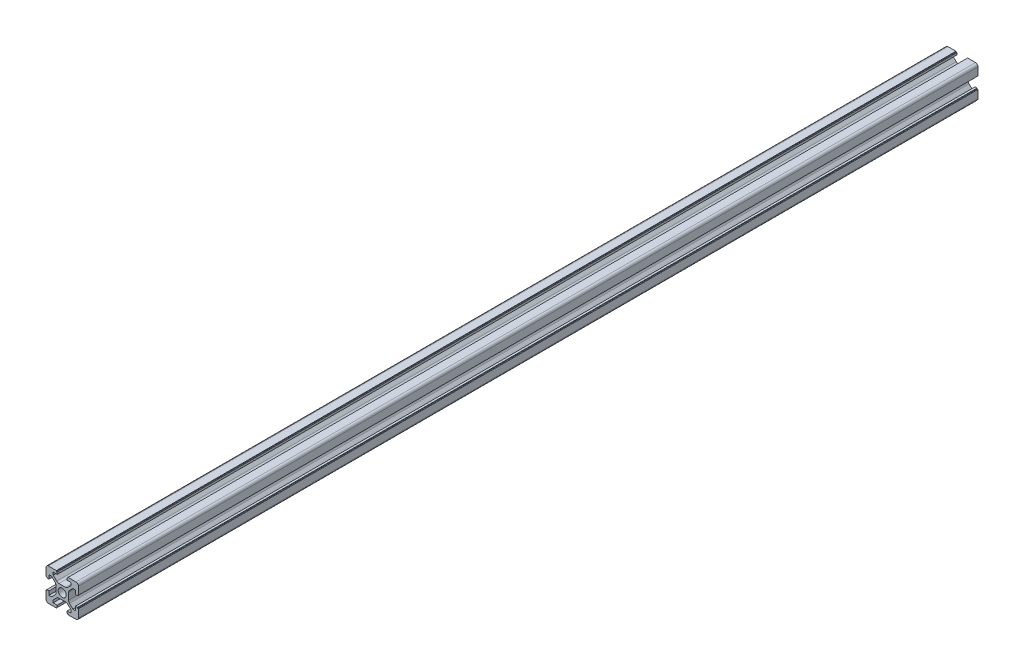
from build123d import *

# Parameters (mm, degrees)
SKETCH1_R      = 2.5
EXTRUDE1_DEPTH = 555


with BuildPart() as part:
    # Sketch1 → Extrude1 (new body)
    with BuildSketch(Plane.XY):
        with BuildLine():
            Line((0, 3.9), (-2.010912703, 3.9))
            ThreePointArc((-2.010912703, 3.9), (-2.776279568, 4.052240935), (-3.425126266, 4.485786438))
            Line((-3.425126266, 4.485786438), (-5.539339828, 6.6))
            Line((-5.539339828, 6.6), (-5.539339828, 8.2))
            Line((-5.539339828, 8.2), (-3.1, 8.2))
            Line((-3.1, 8.2), (-3.1, 9.5))
            Line((-3.1, 9.5), (-3.4, 9.5))
            ThreePointArc((-3.4, 9.5), (-3.541421356, 9.558578644), (-3.6, 9.7))
            Line((-3.6, 9.7), (-3.6, 10))
            Line((-3.6, 10), (-8.5, 10))
            ThreePointArc((-8.5, 10), (-9.560660172, 9.560660172), (-10, 8.5))
            Line((-10, 8.5), (-10, 3.6))
            Line((-10, 3.6), (-9.7, 3.6))
            ThreePointArc((-9.7, 3.6), (-9.558578644, 3.541421356), (-9.5, 3.4))
            Line((-9.5, 3.4), (-9.5, 3.1))
            Line((-9.5, 3.1), (-8.2, 3.1))
            Line((-8.2, 3.1), (-8.2, 5.539339828))
            Line((-8.2, 5.539339828), (-6.6, 5.539339828))
            Line((-6.6, 5.539339828), (-4.485786438, 3.425126266))
            ThreePointArc((-4.485786438, 3.425126266), (-4.052240935, 2.776279568), (-3.9, 2.010912703))
            Line((-3.9, 2.010912703), (-3.9, 0))
            Line((-3.9, 0), (-3.9, -2.010912703))
            ThreePointArc((-3.9, -2.010912703), (-4.052240935, -2.776279568), (-4.485786438, -3.425126266))
            Line((-4.485786438, -3.425126266), (-6.6, -5.539339828))
            Line((-6.6, -5.539339828), (-8.2, -5.539339828))
            Line((-8.2, -5.539339828), (-8.2, -3.1))
            Line((-8.2, -3.1), (-9.5, -3.1))
            Line((-9.5, -3.1), (-9.5, -3.4))
            ThreePointArc((-9.5, -3.4), (-9.558578644, -3.541421356), (-9.7, -3.6))
            Line((-9.7, -3.6), (-10, -3.6))
            Line((-10, -3.6), (-10, -8.5))
            ThreePointArc((-10, -8.5), (-9.560660172, -9.560660172), (-8.5, -10))
            Line((-8.5, -10), (-3.6, -10))
            Line((-3.6, -10), (-3.6, -9.7))
            ThreePointArc((-3.6, -9.7), (-3.541421356, -9.558578644), (-3.4, -9.5))
            Line((-3.4, -9.5), (-3.1, -9.5))
            Line((-3.1, -9.5), (-3.1, -8.2))
            Line((-3.1, -8.2), (-5.539339828, -8.2))
            Line((-5.539339828, -8.2), (-5.539339828, -6.6))
            Line((-5.539339828, -6.6), (-3.425126266, -4.485786438))
            ThreePointArc((-3.425126266, -4.485786438), (-2.776279568, -4.052240935), (-2.010912703, -3.9))
            Line((-2.010912703, -3.9), (0, -3.9))
            Line((0, -3.9), (2.010912703, -3.9))
            ThreePointArc((2.010912703, -3.9), (2.776279568, -4.052240935), (3.425126266, -4.485786438))
            Line((3.425126266, -4.485786438), (5.539339828, -6.6))
            Line((5.539339828, -6.6), (5.539339828, -8.2))
            Line((5.539339828, -8.2), (3.1, -8.2))
            Line((3.1, -8.2), (3.1, -9.5))
            Line((3.1, -9.5), (3.4, -9.5))
            ThreePointArc((3.4, -9.5), (3.541421356, -9.558578644), (3.6, -9.7))
            Line((3.6, -9.7), (3.6, -10))
            Line((3.6, -10), (8.5, -10))
            ThreePointArc((8.5, -10), (9.560660172, -9.560660172), (10, -8.5))
            Line((10, -8.5), (10, -3.6))
            Line((10, -3.6), (9.7, -3.6))
            ThreePointArc((9.7, -3.6), (9.558578644, -3.541421356), (9.5, -3.4))
            Line((9.5, -3.4), (9.5, -3.1))
            Line((9.5, -3.1), (8.2, -3.1))
            Line((8.2, -3.1), (8.2, -5.539339828))
            Line((8.2, -5.539339828), (6.6, -5.539339828))
            Line((6.6, -5.539339828), (4.485786438, -3.425126266))
            ThreePointArc((4.485786438, -3.425126266), (4.052240935, -2.776279568), (3.9, -2.010912703))
            Line((3.9, -2.010912703), (3.9, 0))
            Line((3.9, 0), (3.9, 2.010912703))
            ThreePointArc((3.9, 2.010912703), (4.052240935, 2.776279568), (4.485786438, 3.425126266))
            Line((4.485786438, 3.425126266), (6.6, 5.539339828))
            Line((6.6, 5.539339828), (8.2, 5.539339828))
            Line((8.2, 5.539339828), (8.2, 3.1))
            Line((8.2, 3.1), (9.5, 3.1))
            Line((9.5, 3.1), (9.5, 3.4))
            ThreePointArc((9.5, 3.4), (9.558578644, 3.541421356), (9.7, 3.6))
            Line((9.7, 3.6), (10, 3.6))
            Line((10, 3.6), (10, 8.5))
            ThreePointArc((10, 8.5), (9.560660172, 9.560660172), (8.5, 10))
            Line((8.5, 10), (3.6, 10))
            Line((3.6, 10), (3.6, 9.7))
            ThreePointArc((3.6, 9.7), (3.541421356, 9.558578644), (3.4, 9.5))
            Line((3.4, 9.5), (3.1, 9.5))
            Line((3.1, 9.5), (3.1, 8.2))
            Line((3.1, 8.2), (5.539339828, 8.2))
            Line((5.539339828, 8.2), (5.539339828, 6.6))
            Line((5.539339828, 6.6), (3.425126266, 4.485786438))
            ThreePointArc((3.425126266, 4.485786438), (2.776279568, 4.052240935), (2.010912703, 3.9))
            Line((2.010912703, 3.9), (0, 3.9))
        make_face()
        Circle(SKETCH1_R, mode=Mode.SUBTRACT)
    extrude(amount=EXTRUDE1_DEPTH)


solid = part.part
